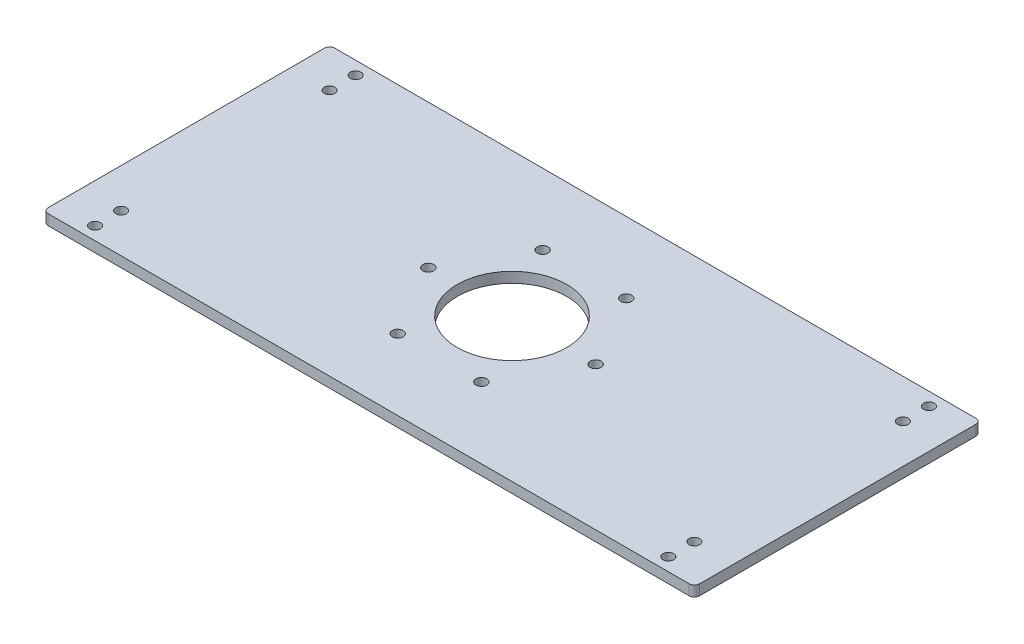
from build123d import *

# Parameters (mm, degrees)
SKETCH_1_W          = 250
SKETCH_1_H          = 110
EXTRUDE_1_DEPTH     = 4
SKETCH_3_R          = 2.1
CUT_EXTRUDE_1_DEPTH = 10
SKETCH_4_R          = 21
CUT_EXTRUDE_2_DEPTH = 10
SKETCH_5_R          = 2.05
CUT_EXTRUDE_3_DEPTH = 10
FILLET_1_R          = 2


with BuildPart() as part:
    # 草图1 → 凸台-拉伸1 (new body)
    with BuildSketch(Plane(origin=(0, 0, 0), x_dir=(1, 0, 0), z_dir=(0, 1, 0))):
        Rectangle(SKETCH_1_W, SKETCH_1_H)
    extrude(amount=EXTRUDE_1_DEPTH)

    # 草图3 → 切除-拉伸1 (cut)
    with BuildSketch(Plane(origin=(0, 4, 0), x_dir=(1, 0, 0), z_dir=(0, 1, 0))):
        with Locations(Location((-32.1, 0, 0), (0, 0, 270))):
            Circle(SKETCH_3_R)
        with Locations(Location((-16.05, 27.799415461, 0), (0, 0, 270))):
            Circle(SKETCH_3_R)
        with Locations(Location((16.05, 27.799415461, 0), (0, 0, 270))):
            Circle(SKETCH_3_R)
        with Locations(Location((32.1, 0, 0), (0, 0, 270))):
            Circle(SKETCH_3_R)
        with Locations(Location((16.05, -27.799415461, 0), (0, 0, 270))):
            Circle(SKETCH_3_R)
        with Locations(Location((-16.05, -27.799415461, 0), (0, 0, 270))):
            Circle(SKETCH_3_R)
    extrude(amount=-CUT_EXTRUDE_1_DEPTH, mode=Mode.SUBTRACT)

    # 草图4 → 切除-拉伸2 (cut)
    with BuildSketch(Plane(origin=(0, 4, 0), x_dir=(1, 0, 0), z_dir=(0, 1, 0))):
        with Locations(Location((0, 0, 0), (0, 0, 270))):
            Circle(SKETCH_4_R)
    extrude(amount=-CUT_EXTRUDE_2_DEPTH, mode=Mode.SUBTRACT)

    # 草图5 → 切除-拉伸3 (cut)
    with BuildSketch(Plane(origin=(0, 4, 0), x_dir=(1, 0, 0), z_dir=(0, 1, 0))):
        with Locations(Location((-110, 50, 0), (0, 0, 270))):
            Circle(SKETCH_5_R)
        with Locations(Location((-110, 40, 0), (0, 0, 270))):
            Circle(SKETCH_5_R)
        with Locations(Location((110, 40, 0), (0, 0, 270))):
            Circle(SKETCH_5_R)
        with Locations(Location((110, 50, 0), (0, 0, 270))):
            Circle(SKETCH_5_R)
        with Locations(Location((110, -50, 0), (0, 0, 270))):
            Circle(SKETCH_5_R)
        with Locations(Location((110, -40, 0), (0, 0, 270))):
            Circle(SKETCH_5_R)
        with Locations(Location((-110, -50, 0), (0, 0, 270))):
            Circle(SKETCH_5_R)
        with Locations(Location((-110, -40, 0), (0, 0, 270))):
            Circle(SKETCH_5_R)
    extrude(amount=-CUT_EXTRUDE_3_DEPTH, mode=Mode.SUBTRACT)

    # 圆角1
    fillet_1_edges = [part.edges().sort_by_distance(p)[0] for p in [
        (125, 2, 55),
        (-125, 2, 55),
        (-125, 2, -55),
        (125, 2, -55),
    ]]
    fillet(fillet_1_edges, radius=FILLET_1_R)


solid = part.part
